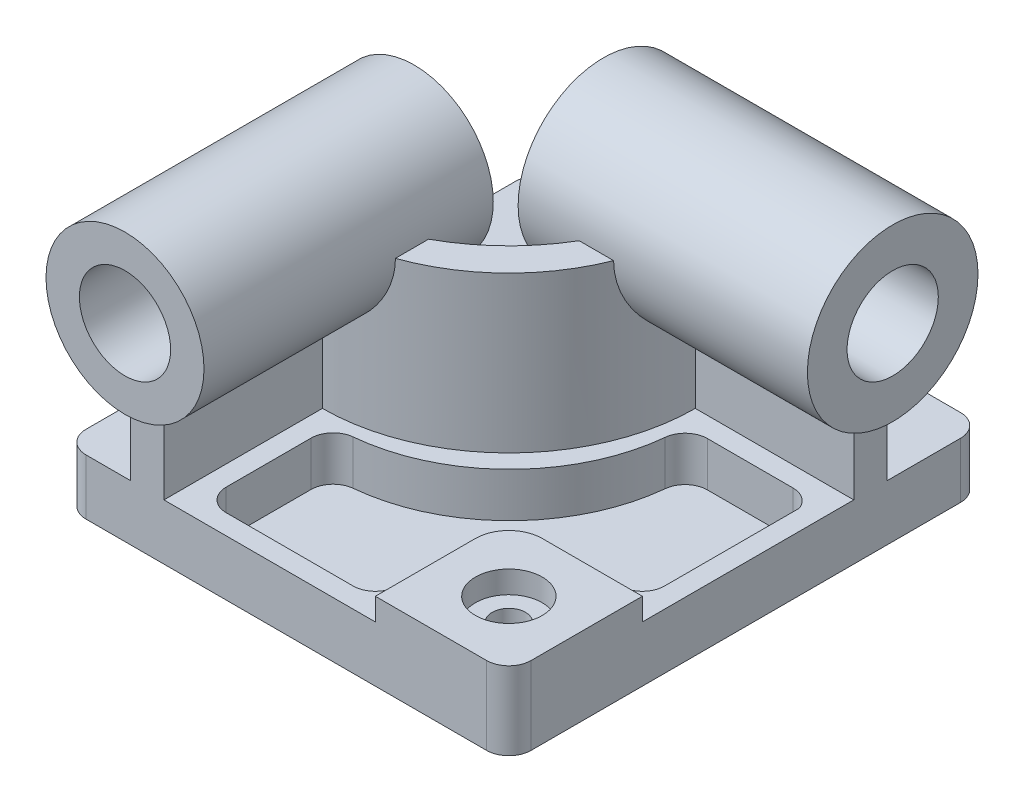
from build123d import *

# Parameters (mm, degrees)
SKETCH1_W                               = 200
SKETCH1_H                               = 213
BOSS_EXTRUDE1_DEPTH                     = 25
SKETCH2_W                               = 60
SKETCH2_H                               = 60
BOSS_EXTRUDE2_DEPTH                     = 10
CUT_EXTRUDE1_DEPTH                      = 20
BOSS_EXTRUDE3_DEPTH                     = 70
BOSS_EXTRUDE5_DEPTH                     = 10
BOSS_EXTRUDE5_DEPTH_BACK                = 120
SKETCH6_R                               = 35.5
BOSS_EXTRUDE6_DEPTH                     = 10
BOSS_EXTRUDE6_DEPTH_BACK                = 120
SKETCH7_R                               = 38.333333333
F_12_0_41_DIAMETER_HOLE1_D              = 41
F_12_0MM_DOWEL_HOLE1_D                  = 41
CBORE_FOR_M8_HEX_HEAD_BOLT1_D           = 15
CBORE_FOR_M8_HEX_HEAD_BOLT1_CBORE_D     = 30
CBORE_FOR_M8_HEX_HEAD_BOLT1_CBORE_DEPTH = 10
FILLET1_R                               = 10
FILLET2_R                               = 15


with BuildPart() as part:
    # Sketch1 → Boss-Extrude1 (new body)
    with BuildSketch(Plane(origin=(0, 0, 0), x_dir=(1, 0, 0), z_dir=(0, 1, 0))):
        with Locations((100, -106.5)):
            Rectangle(SKETCH1_W, SKETCH1_H)
    extrude(amount=BOSS_EXTRUDE1_DEPTH)

    # Sketch2 → Boss-Extrude2 (add)
    with BuildSketch(Plane(origin=(0, 25, 0), x_dir=(1, 0, 0), z_dir=(0, 1, 0))):
        with Locations((170, -183)):
            Rectangle(SKETCH2_W, SKETCH2_H)
    extrude(amount=BOSS_EXTRUDE2_DEPTH)

    # Sketch5 → Cut-Extrude1 (cut)
    with BuildSketch(Plane(origin=(0, 25, 0), x_dir=(1, 0, 0), z_dir=(0, 1, 0))):
        with BuildLine():
            Line((191, -73.400231973), (191, -134))
            ThreePointArc((191, -134), (188.071067812, -141.071067812), (181, -144))
            Line((181, -144), (145.524792721, -144))
            ThreePointArc((145.524792721, -144), (135.254213293, -148.254213293), (131, -158.524792721))
            Line((131, -158.524792721), (131, -194))
            ThreePointArc((131, -194), (128.071067812, -201.071067812), (121, -204))
            Line((121, -204), (64, -204))
            ThreePointArc((64, -204), (56.928932188, -201.071067812), (54, -194))
            Line((54, -194), (54, -155.925475005))
            ThreePointArc((54, -155.925475005), (56.596304606, -149.203474223), (63.037058903, -145.97194576))
            ThreePointArc((63.037058903, -145.97194576), (110.669303842, -123.548265985), (133.270417334, -75.999955378))
            ThreePointArc((133.270417334, -75.999955378), (136.512099917, -69.583786471), (143.22028722, -67))
            Line((143.22028722, -67), (181.67038746, -67))
            ThreePointArc((181.67038746, -67), (187.327344227, -68.753859076), (191, -73.400231973))
        make_face()
    extrude(amount=-CUT_EXTRUDE1_DEPTH, mode=Mode.SUBTRACT)

    # Sketch3 → Boss-Extrude3 (add)
    with BuildSketch(Plane(origin=(0, 25, 0), x_dir=(1, 0, 0), z_dir=(0, 1, 0))):
        with BuildLine():
            Line((30, -213), (30, -133))
            ThreePointArc((30, -133), (93.639610307, -106.639610307), (120, -43))
            Line((120, -43), (200, -43))
            Line((200, -43), (200, -58))
            Line((200, -58), (128.786796564, -58))
            ThreePointArc((128.786796564, -58), (104.246212025, -117.246212025), (45, -141.786796564))
            Line((45, -141.786796564), (45, -213))
            Line((45, -213), (30, -213))
        make_face()
    extrude(amount=BOSS_EXTRUDE3_DEPTH)

    # Sketch6 → Boss-Extrude5 (add, two sides: drawn at the far end of the back side and taken through both)
    with BuildSketch(Plane.XY.offset(213).offset(-BOSS_EXTRUDE5_DEPTH_BACK)):
        with Locations((37.5, 95)):
            Circle(SKETCH6_R)
    extrude(amount=BOSS_EXTRUDE5_DEPTH + BOSS_EXTRUDE5_DEPTH_BACK)

    # Sketch7 → Boss-Extrude6 (add, two sides: drawn at the far end of the back side and taken through both)
    with BuildSketch(Plane(origin=(200, 0, 0), x_dir=(0, 0, -1), z_dir=(1, 0, 0)).offset(-BOSS_EXTRUDE6_DEPTH_BACK)):
        with Locations((-50.5, 95)):
            Circle(SKETCH7_R)
    extrude(amount=BOSS_EXTRUDE6_DEPTH + BOSS_EXTRUDE6_DEPTH_BACK)

    # Ø12.0 (41) Diameter Hole1 (through all)
    with Locations(Plane(origin=(210, 0, 0), x_dir=(0, 0, -1), z_dir=(1, 0, 0))):
        with Locations((-50.5, 95)):
            Hole(F_12_0_41_DIAMETER_HOLE1_D / 2)

    # Ø12.0mm Dowel Hole1 (through all)
    with Locations(Plane.XY.offset(223)):
        with Locations((37.5, 95)):
            Hole(F_12_0MM_DOWEL_HOLE1_D / 2)

    # CBORE for M8 Hex Head Bolt1 (through all)
    with Locations(Plane(origin=(0, 35, 0), x_dir=(1, 0, 0), z_dir=(0, 1, 0))):
        with Locations((170, -183)):
            CounterBoreHole(CBORE_FOR_M8_HEX_HEAD_BOLT1_D / 2, CBORE_FOR_M8_HEX_HEAD_BOLT1_CBORE_D / 2, CBORE_FOR_M8_HEX_HEAD_BOLT1_CBORE_DEPTH)

    # Fillet1
    fillet1_edges = [part.edges().sort_by_distance(p)[0] for p in [
        (0, 12.5, 0),
        (200, 12.5, 0),
        (200, 17.5, 213),
        (0, 12.5, 213),
    ]]
    fillet(fillet1_edges, radius=FILLET1_R)

    # Fillet2
    fillet2_edges = [part.edges().sort_by_distance(p)[0] for p in [
        (140, 30, 153),
    ]]
    fillet(fillet2_edges, radius=FILLET2_R)


solid = part.part
